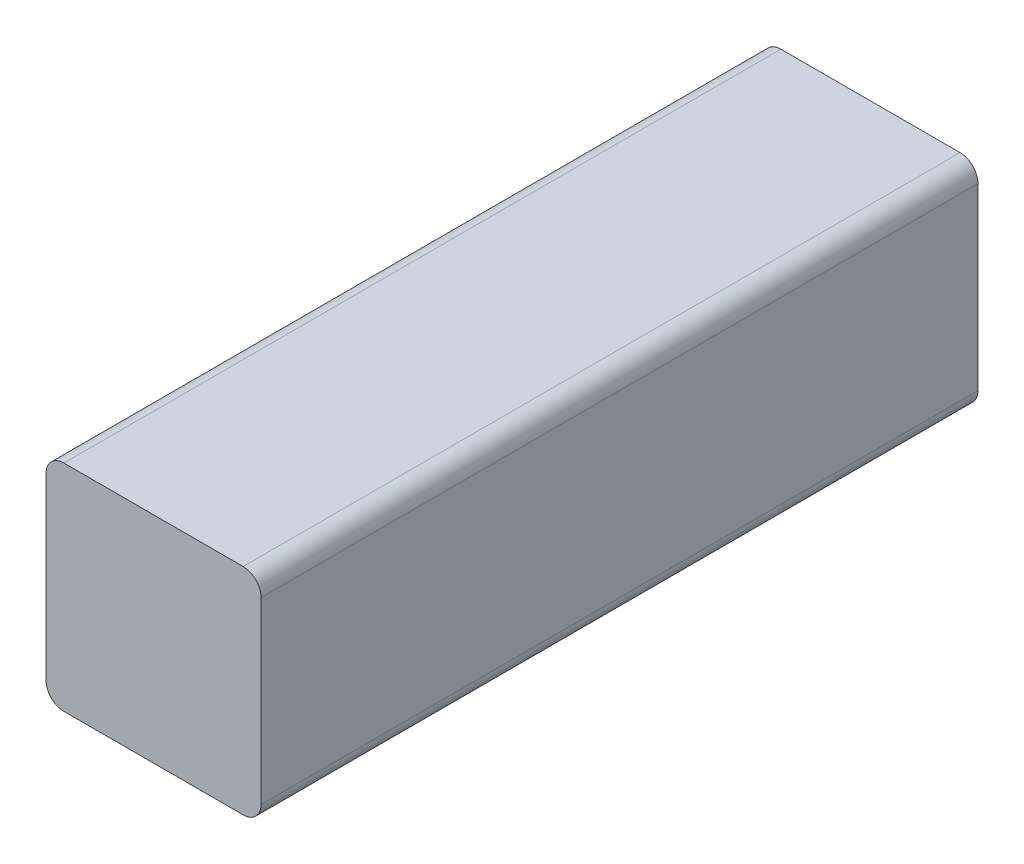
from build123d import *

# Parameters (mm, degrees)
RESSALTO_EXTRUS_O1_DEPTH = 20


with BuildPart() as part:
    # Esboço1 → Ressalto-extrusão1 (new body)
    with BuildSketch(Plane.XY):
        with BuildLine():
            Line((2.5, 11.3), (-2.5, 11.3))
            ThreePointArc((-2.5, 11.3), (-2.853553391, 11.153553391), (-3, 10.8))
            Line((-3, 10.8), (-3, 5.8))
            ThreePointArc((-3, 5.8), (-2.853553391, 5.446446609), (-2.5, 5.3))
            Line((-2.5, 5.3), (2.5, 5.3))
            ThreePointArc((2.5, 5.3), (2.853553391, 5.446446609), (3, 5.8))
            Line((3, 5.8), (3, 10.8))
            ThreePointArc((3, 10.8), (2.853553391, 11.153553391), (2.5, 11.3))
        make_face()
    extrude(amount=-RESSALTO_EXTRUS_O1_DEPTH)


solid = part.part
